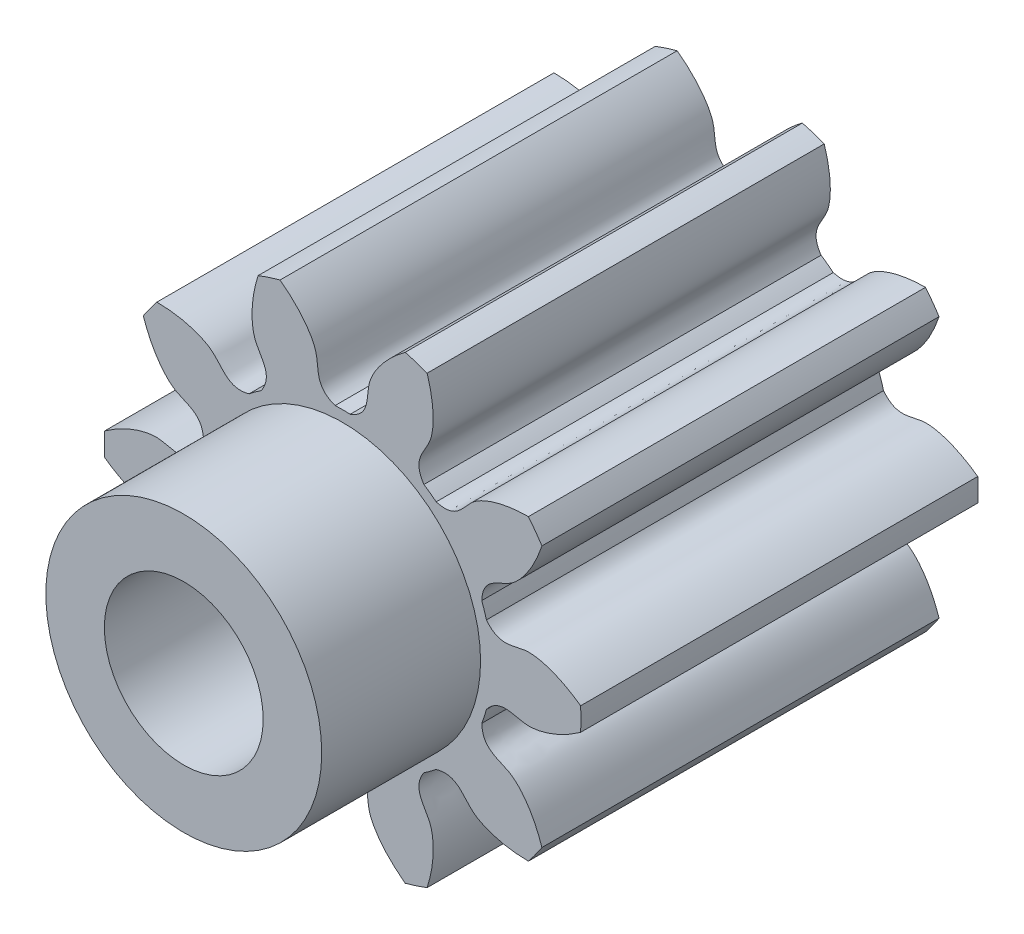
from build123d import *
from build123d.topology import SkipClean

# Parameters (mm, degrees)
SKETCH_1_R               = 3
EXTRUDE_1_DEPTH          = 5
CUT_EXTRUDE_1_DEPTH      = 7.557438524
PATTERN_CIRCULAR_1_COUNT = 10
CUT_EXTRUDE_2_REACH      = 8.51
SKETCH_4_R               = 1
SKETCH_5_R               = 1.736781516
SKETCH_5_R_2             = 1
EXTRUDE_2_DEPTH          = 2


with BuildPart() as part:
    # 草图1 → 凸台-拉伸1 (new body)
    with BuildSketch(Plane.XY):
        Circle(SKETCH_1_R)
    extrude(amount=EXTRUDE_1_DEPTH)

    # 草图2 → 切除-拉伸1 (cut, through all)
    with BuildSketch(Plane.XY):
        with BuildLine():
            ThreePointArc((0.095229133, 1.872580148), (0, 1.875), (-0.095229133, 1.872580148))
            add(Edge.make_bspline(
                [(-0.095229133, 1.872580148), (-0.362715165, 1.970284093), (-0.286920777, 2.185294723), (-0.344330803, 2.362336277), (-0.347251515, 2.37077245), (-0.350665635, 2.380030264), (-0.35460634, 2.390093167), (-0.359107284, 2.400943399), (-0.364201322, 2.412562246), (-0.369920867, 2.424929978), (-0.376297744, 2.438025881), (-0.383363205, 2.451828275), (-0.391147884, 2.466314521), (-0.399681784, 2.481461042), (-0.408994243, 2.497243338), (-0.419113912, 2.513636003), (-0.430068732, 2.530612743), (-0.441885908, 2.548146397), (-0.454591887, 2.566208951), (-0.468212335, 2.58477156), (-0.482772111, 2.603804571), (-0.498295251, 2.623277538), (-0.514804941, 2.64315925), (-0.532323498, 2.663417745), (-0.550872351, 2.68402034), (-0.570472019, 2.704933651), (-0.591142092, 2.726123613), (-0.612901212, 2.747555509), (-0.635767055, 2.769193992), (-0.659756316, 2.79100311), (-0.684884687, 2.812946332), (-0.711166843, 2.834986573), (-0.73861643, 2.857086218), (-0.767246042, 2.879207155), (-0.797067213, 2.901310796), (-0.828090401, 2.923358104), (-0.860324974, 2.945309627), (-0.8937792, 2.967125519), (-0.928460232, 2.988765572), (-0.964374099, 3.010189244), (-1.001525696, 3.031355689), (-1.039918773, 3.052223783), (-1.079555927, 3.072752157), (-1.120438592, 3.092899225), (-1.162567035, 3.112623216), (-1.205940346, 3.131882201), (-1.250556433, 3.150634125), (-1.296412017, 3.168836838), (-1.343502628, 3.186448125), (-1.3918226, 3.203425737), (-1.441365068, 3.219727424), (-1.492121969, 3.235310961), (-1.544084033, 3.250134185), (-1.597240793, 3.264155023), (-1.651580574, 3.277331523), (-1.707090504, 3.289621887), (-1.763756505, 3.300984501), (-1.821563307, 3.311377967), (-1.880494441, 3.320761135), (-1.940532246, 3.329093134), (-2.022655253, 3.338820511), (-2.084917451, 3.344293469), (-2.126793313, 3.34714445)],
                knots=[0, 0, 0, 0, 0.201720712, 0.204696754, 0.208022917, 0.211699204, 0.215725612, 0.220102144, 0.224828797, 0.229905574, 0.235332472, 0.241109493, 0.247236637, 0.253713903, 0.260541292, 0.267718803, 0.275246437, 0.283124193, 0.291352071, 0.299930073, 0.308858196, 0.318136442, 0.327764811, 0.337743302, 0.348071916, 0.358750652, 0.36977951, 0.381158491, 0.392887595, 0.404966821, 0.41739617, 0.430175641, 0.443305234, 0.45678495, 0.470614789, 0.48479475, 0.499324833, 0.514205039, 0.529435368, 0.545015819, 0.560946392, 0.577227088, 0.593857907, 0.610838848, 0.628169911, 0.645851097, 0.663882406, 0.682263837, 0.70099539, 0.720077066, 0.739508864, 0.759290785, 0.779422829, 0.799904995, 0.820737283, 0.841919694, 0.863452227, 0.885334883, 0.907567662, 0.930150562, 0.953083586, 1, 1, 1, 1], degree=3))
            ThreePointArc((-2.126793313, 3.34714445), (0, 3.965680996), (2.126793313, 3.34714445))
            add(Edge.make_bspline(
                [(0.095229133, 1.872580148), (0.362715165, 1.970284093), (0.286920777, 2.185294723), (0.344330803, 2.362336277), (0.347251515, 2.37077245), (0.350665635, 2.380030264), (0.35460634, 2.390093167), (0.359107284, 2.400943399), (0.364201322, 2.412562246), (0.369920867, 2.424929978), (0.376297744, 2.438025881), (0.383363205, 2.451828275), (0.391147884, 2.466314521), (0.399681784, 2.481461042), (0.408994243, 2.497243338), (0.419113912, 2.513636003), (0.430068732, 2.530612743), (0.441885908, 2.548146397), (0.454591887, 2.566208951), (0.468212335, 2.58477156), (0.482772111, 2.603804571), (0.498295251, 2.623277538), (0.514804941, 2.64315925), (0.532323498, 2.663417745), (0.550872351, 2.68402034), (0.570472019, 2.704933651), (0.591142092, 2.726123613), (0.612901212, 2.747555509), (0.635767055, 2.769193992), (0.659756316, 2.79100311), (0.684884687, 2.812946332), (0.711166843, 2.834986573), (0.73861643, 2.857086218), (0.767246042, 2.879207155), (0.797067213, 2.901310796), (0.828090401, 2.923358104), (0.860324974, 2.945309627), (0.8937792, 2.967125519), (0.928460232, 2.988765572), (0.964374099, 3.010189244), (1.001525696, 3.031355689), (1.039918773, 3.052223783), (1.079555927, 3.072752157), (1.120438592, 3.092899225), (1.162567035, 3.112623216), (1.205940346, 3.131882201), (1.250556433, 3.150634125), (1.296412017, 3.168836838), (1.343502628, 3.186448125), (1.3918226, 3.203425737), (1.441365068, 3.219727424), (1.492121969, 3.235310961), (1.544084033, 3.250134185), (1.597240793, 3.264155023), (1.651580574, 3.277331523), (1.707090504, 3.289621887), (1.763756505, 3.300984501), (1.821563307, 3.311377967), (1.880494441, 3.320761135), (1.940532246, 3.329093134), (2.022655253, 3.338820511), (2.084917451, 3.344293469), (2.126793313, 3.34714445)],
                knots=[0, 0, 0, 0, 0.201720712, 0.204696754, 0.208022917, 0.211699204, 0.215725612, 0.220102144, 0.224828797, 0.229905574, 0.235332472, 0.241109493, 0.247236637, 0.253713903, 0.260541292, 0.267718803, 0.275246437, 0.283124193, 0.291352071, 0.299930073, 0.308858196, 0.318136442, 0.327764811, 0.337743302, 0.348071916, 0.358750652, 0.36977951, 0.381158491, 0.392887595, 0.404966821, 0.41739617, 0.430175641, 0.443305234, 0.45678495, 0.470614789, 0.48479475, 0.499324833, 0.514205039, 0.529435368, 0.545015819, 0.560946392, 0.577227088, 0.593857907, 0.610838848, 0.628169911, 0.645851097, 0.663882406, 0.682263837, 0.70099539, 0.720077066, 0.739508864, 0.759290785, 0.779422829, 0.799904995, 0.820737283, 0.841919694, 0.863452227, 0.885334883, 0.907567662, 0.930150562, 0.953083586, 1, 1, 1, 1], degree=3))
        make_face()
    cut_extrude_1 = extrude(amount=CUT_EXTRUDE_1_DEPTH, mode=Mode.SUBTRACT)

    # 阵列(圆周)1: 切除-拉伸1 ×10 about axis
    pattern_circular_1_axis = Axis((0, 0, -0.3), (0, 0, 1))
    for i in range(1, PATTERN_CIRCULAR_1_COUNT):
        add(cut_extrude_1.rotate(pattern_circular_1_axis, i * 360 / PATTERN_CIRCULAR_1_COUNT), mode=Mode.SUBTRACT)

    # 草图4 → 切除-拉伸2 (cut, up to next)
    with BuildSketch(Plane(origin=(0, 0, 0), x_dir=(-1, 0, 0), z_dir=(0, 0, -1)), mode=Mode.PRIVATE) as cut_extrude_2_sk1:
        Circle(SKETCH_4_R)
    cut_extrude_2_tool1 = extrude(cut_extrude_2_sk1.sketch, amount=-CUT_EXTRUDE_2_REACH, mode=Mode.PRIVATE) & part.part
    add(cut_extrude_2_tool1.solids().sort_by_distance((0, 0, 0))[0], mode=Mode.SUBTRACT)

    # 草图5 → 凸台-拉伸2 (add)
    with SkipClean():  # the faces are left unmerged after this step: merging them gives an invalid solid
        with BuildSketch(Plane.XY.offset(5)):
            Circle(SKETCH_5_R)
            Circle(SKETCH_5_R_2, mode=Mode.SUBTRACT)
        extrude(amount=EXTRUDE_2_DEPTH)


solid = part.part
